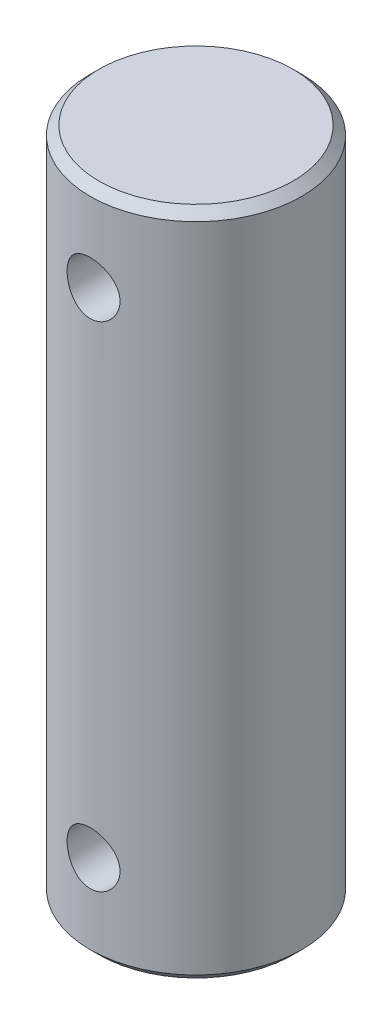
from build123d import *

# Parameters (mm, degrees)
SKETCH1_R               = 6
BOSS_EXTRUDE1_DEPTH     = 38
CUT_EXTRUDE1_DEPTH      = 39.935844668
CUT_EXTRUDE1_DEPTH_BACK = 39.935844668
SKETCH2_R               = 1.5
CHAMFER1_SIZE           = 0.5


with BuildPart() as part:
    # Sketch1 → Boss-Extrude1 (new body)
    with BuildSketch(Plane(origin=(0, 0, 0), x_dir=(1, 0, 0), z_dir=(0, 1, 0))):
        with Locations(Location((0, 0, 0), (0, 0, 270))):
            Circle(SKETCH1_R)
    extrude(amount=BOSS_EXTRUDE1_DEPTH)

    # Sketch2 → Cut-Extrude1 (cut, two sides: drawn at the far end of the back side and taken through both)
    with BuildSketch(Plane.XY.offset(-CUT_EXTRUDE1_DEPTH_BACK)):
        with Locations(Location((0, 5, 0), (0, 0, 90.000000004))):
            Circle(SKETCH2_R)
        with Locations(Location((0, 33, 0), (0, 0, 90.000000004))):
            Circle(SKETCH2_R)
    extrude(amount=CUT_EXTRUDE1_DEPTH + CUT_EXTRUDE1_DEPTH_BACK, mode=Mode.SUBTRACT)

    # Chamfer1
    chamfer1_edges = [part.edges().sort_by_distance(p)[0] for p in [
        (0, 0, -6),
        (0, 38, -6),
    ]]
    chamfer(chamfer1_edges, length=CHAMFER1_SIZE)


solid = part.part
